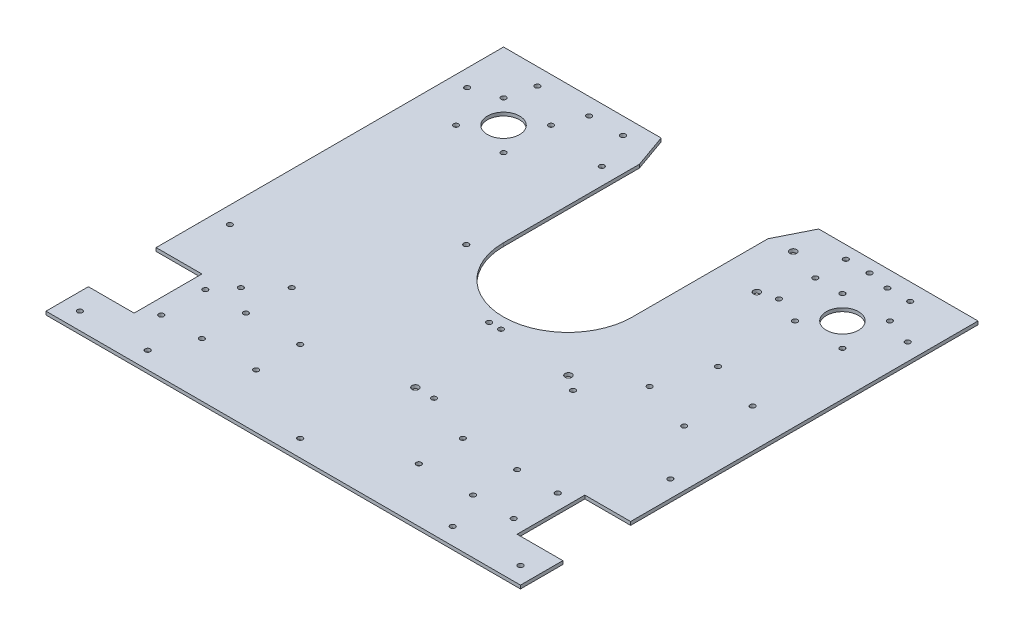
from build123d import *

# Parameters (mm, degrees)
ESQUISSE1_R      = 1.5
ESQUISSE1_R_2    = 9.5
EXTRUSION1_DEPTH = 2
EXTRUSION3_DEPTH = 311.873244438
ESQUISSE4_R      = 1.5
ESQUISSE4_R_2    = 2
EXTRUSION4_DEPTH = 10
ESQUISSE5_R      = 1.5
ESQUISSE5_R_2    = 2
EXTRUSION5_DEPTH = 10
EXTRUSION6_DEPTH = 10
ESQUISSE7_R      = 1.5
EXTRUSION7_DEPTH = 10
ESQUISSE8_R      = 1.5
EXTRUSION8_DEPTH = 10


with BuildPart() as part:
    # Esquisse1 → Extrusion1 (new body)
    with BuildSketch(Plane(origin=(0, 0, 0), x_dir=(1, 0, 0), z_dir=(0, 1, 0))):
        Polygon((215.226575971, 224.311602694), (-64.773424029, 224.311602694), (-64.773424029, 19.311602694), (-37.773424029, 19.311602694), (-37.773424029, -20.688397306), (-64.773424029, -20.688397306), (-64.773424029, -45.688397306), (215.226575971, -45.688397306), (215.226575971, -20.688397306), (188.226575971, -20.688397306), (188.226575971, 19.311602694), (215.226575971, 19.311602694), align=None)
        with Locations(Location((27.226575971, 12.311602694, 0), (0, 0, 270))):
            Circle(ESQUISSE1_R, mode=Mode.SUBTRACT)
        with Locations(Location((27.226575971, -13.688397306, 0), (0, 0, 270))):
            Circle(ESQUISSE1_R, mode=Mode.SUBTRACT)
        with Locations(Location((123.226575971, -13.688397306, 0), (0, 0, 90))):
            Circle(ESQUISSE1_R, mode=Mode.SUBTRACT)
        with Locations(Location((-54.773424029, -35.688397306, 0), (0, 0, 270))):
            Circle(ESQUISSE1_R, mode=Mode.SUBTRACT)
        with Locations(Location((205.226575971, -35.688397306, 0), (0, 0, 90))):
            Circle(ESQUISSE1_R, mode=Mode.SUBTRACT)
        with Locations(Location((-28.773424029, 12.311602694, 0), (0, 0, 270))):
            Circle(ESQUISSE1_R, mode=Mode.SUBTRACT)
        with Locations(Location((-28.773424029, -13.688397306, 0), (0, 0, 270))):
            Circle(ESQUISSE1_R, mode=Mode.SUBTRACT)
        with Locations(Location((-4.773424029, 12.311602694, 0), (0, 0, 270))):
            Circle(ESQUISSE1_R, mode=Mode.SUBTRACT)
        with Locations(Location((-4.773424029, -13.688397306, 0), (0, 0, 270))):
            Circle(ESQUISSE1_R, mode=Mode.SUBTRACT)
        with Locations(Location((165.226575971, -35.688397306, 0), (0, 0, 90))):
            Circle(ESQUISSE1_R, mode=Mode.SUBTRACT)
        with Locations(Location((155.226575971, -13.688397306, 0), (0, 0, 90))):
            Circle(ESQUISSE1_R, mode=Mode.SUBTRACT)
        with Locations(Location((155.226575971, 12.311602694, 0), (0, 0, 90))):
            Circle(ESQUISSE1_R, mode=Mode.SUBTRACT)
        with Locations(Location((179.226575971, -13.688397306, 0), (0, 0, 90))):
            Circle(ESQUISSE1_R, mode=Mode.SUBTRACT)
        with Locations(Location((179.226575971, 12.311602694, 0), (0, 0, 90))):
            Circle(ESQUISSE1_R, mode=Mode.SUBTRACT)
        with Locations(Location((-24.773424029, 184.311602694, 0), (0, 0, 270))):
            Circle(ESQUISSE1_R_2, mode=Mode.SUBTRACT)
        with Locations(Location((-38.773424029, 198.311602694, 0), (0, 0, 270))):
            Circle(ESQUISSE1_R, mode=Mode.SUBTRACT)
        with Locations(Location((-10.773424029, 170.311602694, 0), (0, 0, 270))):
            Circle(ESQUISSE1_R, mode=Mode.SUBTRACT)
        with Locations(Location((-38.773424029, 170.311602694, 0), (0, 0, 270))):
            Circle(ESQUISSE1_R, mode=Mode.SUBTRACT)
        with Locations(Location((-10.773424029, 198.311602694, 0), (0, 0, 270))):
            Circle(ESQUISSE1_R, mode=Mode.SUBTRACT)
        with Locations(Location((161.226575971, 198.311602694, 0), (0, 0, 90))):
            Circle(ESQUISSE1_R, mode=Mode.SUBTRACT)
        with Locations(Location((189.226575971, 170.311602694, 0), (0, 0, 90))):
            Circle(ESQUISSE1_R, mode=Mode.SUBTRACT)
        with Locations(Location((161.226575971, 170.311602694, 0), (0, 0, 90))):
            Circle(ESQUISSE1_R, mode=Mode.SUBTRACT)
        with Locations(Location((189.226575971, 198.311602694, 0), (0, 0, 90))):
            Circle(ESQUISSE1_R, mode=Mode.SUBTRACT)
        with Locations(Location((175.226575971, 184.311602694, 0), (0, 0, 90))):
            Circle(ESQUISSE1_R_2, mode=Mode.SUBTRACT)
        with Locations(Location((-14.773424029, -35.688397306, 0), (0, 0, 270))):
            Circle(ESQUISSE1_R, mode=Mode.SUBTRACT)
        with Locations(Location((75.226575971, -35.688397306, 0), (0, 0, 270))):
            Circle(ESQUISSE1_R, mode=Mode.SUBTRACT)
        with Locations(Location((123.226575971, 12.311602694, 0), (0, 0, 90))):
            Circle(ESQUISSE1_R, mode=Mode.SUBTRACT)
    extrude(amount=EXTRUSION1_DEPTH)

    # Esquisse3 → Extrusion3 (cut, through all)
    with BuildSketch(Plane(origin=(0, 2, 0), x_dir=(-1, 0, 0), z_dir=(0, 1, 0))):
        with BuildLine():
            Line((-35.226575971, -224.311602694), (-35.226575971, -124.311602694))
            ThreePointArc((-35.226575971, -124.311602694), (-73.226575971, -86.311602694), (-111.226575971, -124.311602694))
            Line((-111.226575971, -124.311602694), (-111.226575971, -224.311602694))
            Line((-111.226575971, -224.311602694), (-35.226575971, -224.311602694))
        make_face()
    extrude(amount=-EXTRUSION3_DEPTH, mode=Mode.SUBTRACT)

    # Esquisse4 → Extrusion4 (cut)
    with BuildSketch(Plane.XZ):
        with Locations(Location((-54.773424029, -192.811602694, 0), (0, 0, 270))):
            Circle(ESQUISSE4_R)
        with Locations(Location((-54.773424029, -52.811602694, 0), (0, 0, 270))):
            Circle(ESQUISSE4_R)
        with Locations(Location((205.226575971, -52.811602694, 0), (0, 0, 90))):
            Circle(ESQUISSE4_R)
        with Locations(Location((205.226575971, -192.811602694, 0), (0, 0, 90))):
            Circle(ESQUISSE4_R)
        with Locations(Location((-34.773424029, -214.311602694, 0), (0, 0, 270))):
            Circle(ESQUISSE4_R)
        with Locations(Location((-4.273424029, -214.311602694, 0), (0, 0, 270))):
            Circle(ESQUISSE4_R)
        with Locations(Location((171.726575971, -214.311602694, 0), (0, 0, 270))):
            Circle(ESQUISSE4_R)
        with Locations(Location((185.226575971, -214.311602694, 0), (0, 0, 90))):
            Circle(ESQUISSE4_R)
        with Locations(Location((15.726575971, -214.311602694, 0), (0, 0, 270))):
            Circle(ESQUISSE4_R)
        with Locations(Location((158.726575971, -216.811602694, 0), (0, 0, 270))):
            Circle(ESQUISSE4_R)
        with Locations(Location((25.226575971, -192.311602694, 0), (0, 0, 270))):
            Circle(ESQUISSE4_R)
        with Locations(Location((25.226575971, -112.311602694, 0), (0, 0, 270))):
            Circle(ESQUISSE4_R)
        with Locations(Location((144.726575971, -216.811602694, 0), (0, 0, 270))):
            Circle(ESQUISSE4_R)
        with Locations(Location((125.226575971, -205.311602694, 0), (0, 0, 270))):
            Circle(ESQUISSE4_R_2)
        with Locations(Location((145.226575971, -176.811602694, 0), (0, 0, 270))):
            Circle(ESQUISSE4_R)
        with Locations(Location((145.226575971, -198.311602694, 0), (0, 0, 270))):
            Circle(ESQUISSE4_R)
        with Locations(Location((135.226575971, -173.811602694, 0), (0, 0, 270))):
            Circle(ESQUISSE4_R_2)
    extrude(amount=-EXTRUSION4_DEPTH, mode=Mode.SUBTRACT)

    # Esquisse5 → Extrusion5 (cut)
    with BuildSketch(Plane(origin=(0, 2, 0), x_dir=(-1, 0, 0), z_dir=(0, 1, 0))):
        with Locations(Location((-131.226575971, -69.311602694, 0), (0, 0, 90))):
            Circle(ESQUISSE5_R)
        with Locations(Location((-122.226575971, -75.636158015, 0), (0, 0, 90))):
            Circle(ESQUISSE5_R_2)
        with Locations(Location((-151.829207664, -93.914234387, 0), (0, 0, 90))):
            Circle(ESQUISSE5_R)
        with Locations(Location((-161.829207664, -124.311602694, 0), (0, 0, 90))):
            Circle(ESQUISSE5_R)
        with Locations(Location((-83.226575971, -24.311602694, 0), (0, 0, 90))):
            Circle(ESQUISSE5_R_2)
        with Locations(Location((-94.226575971, -24.311602694, 0), (0, 0, 90))):
            Circle(ESQUISSE5_R)
        with Locations(Location((-192.226575971, -114.311602694, 0), (0, 0, 90))):
            Circle(ESQUISSE5_R)
        with Locations(Location((-182.226575971, -83.914234387, 0), (0, 0, 90))):
            Circle(ESQUISSE5_R)
    extrude(amount=-EXTRUSION5_DEPTH, mode=Mode.SUBTRACT)

    # Esquisse6 → Extrusion6 (cut)
    with BuildSketch(Plane(origin=(0, 2, 0), x_dir=(-1, 0, 0), z_dir=(0, 1, 0))):
        Polygon((-28.226575971, -224.311602694), (-38.226575971, -224.311602694), (-35.226575971, -204.537882761), align=None)
        Polygon((-111.226575971, -224.311602694), (-121.226575971, -224.311602694), (-111.226575971, -204.311602694), align=None)
    extrude(amount=-EXTRUSION6_DEPTH, mode=Mode.SUBTRACT)

    # Esquisse7 → Extrusion7 (cut)
    with BuildSketch(Plane(origin=(0, 2, 0), x_dir=(-1, 0, 0), z_dir=(0, 1, 0))):
        with Locations(Location((-71.726575971, -79.311602694, 0), (0, 0, 90))):
            Circle(ESQUISSE7_R)
        with Locations(Location((-78.726575971, -79.311602694, 0), (0, 0, 90))):
            Circle(ESQUISSE7_R)
    extrude(amount=-EXTRUSION7_DEPTH, mode=Mode.SUBTRACT)

    # Esquisse8 → Extrusion8 (cut)
    with BuildSketch(Plane(origin=(0, 2, 0), x_dir=(-1, 0, 0), z_dir=(0, 1, 0))):
        with Locations(Location((19.273424029, -23.811602694, 0), (0, 0, 90))):
            Circle(ESQUISSE8_R)
        with Locations(Location((4.273424029, -38.811602694, 0), (0, 0, 90))):
            Circle(ESQUISSE8_R)
    extrude(amount=-EXTRUSION8_DEPTH, mode=Mode.SUBTRACT)


solid = part.part
